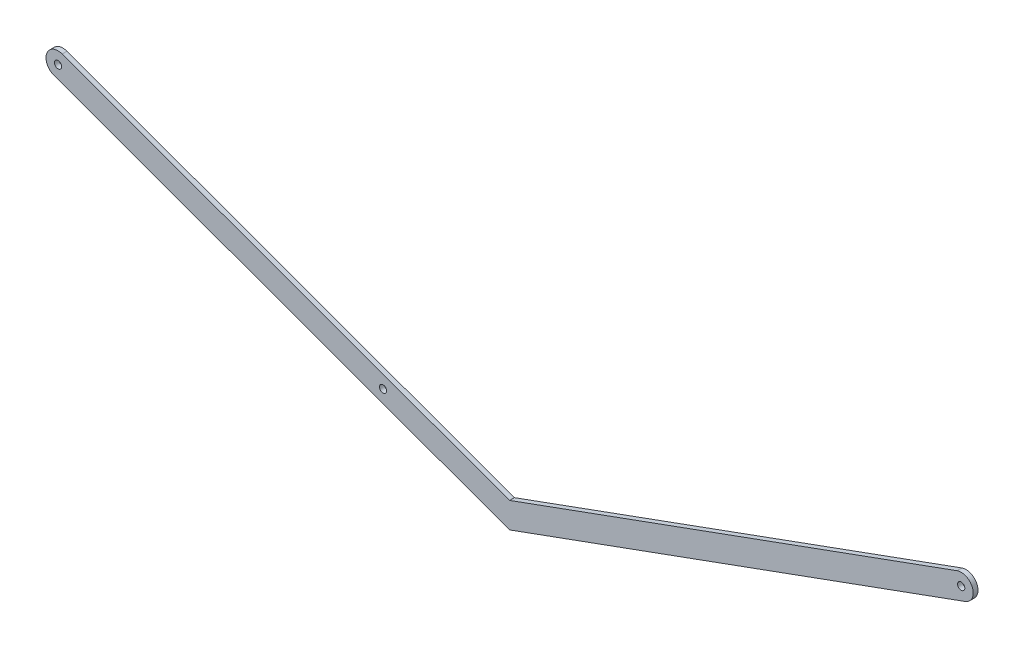
from build123d import *

# Parameters (mm, degrees)
SKETCH1_R           = 4.7625
BOSS_EXTRUDE1_DEPTH = 3.175


with BuildPart() as part:
    # Sketch1 → Boss-Extrude1 (new, symmetric)
    with BuildSketch(Plane.XY):
        with BuildLine():
            Line((-602.329569775, -14.917620355), (0, -234.147654972))
            Line((0, -234.147654972), (602.329569775, -14.917620355))
            ThreePointArc((602.329569775, -14.917620355), (611.817620355, 5.429569775), (591.470430225, 14.917620355))
            Line((591.470430225, 14.917620355), (0, -200.360010695))
            Line((0, -200.360010695), (-591.470430225, 14.917620355))
            ThreePointArc((-591.470430225, 14.917620355), (-611.817620355, 5.429569775), (-602.329569775, -14.917620355))
        make_face()
        with Locations((-596.9, 0)):
            Circle(SKETCH1_R, mode=Mode.SUBTRACT)
        with Locations((596.9, 0)):
            Circle(SKETCH1_R, mode=Mode.SUBTRACT)
        with Locations((-167.272533777, -156.371609528)):
            Circle(SKETCH1_R, mode=Mode.SUBTRACT)
    extrude(amount=BOSS_EXTRUDE1_DEPTH, both=True)


solid = part.part
